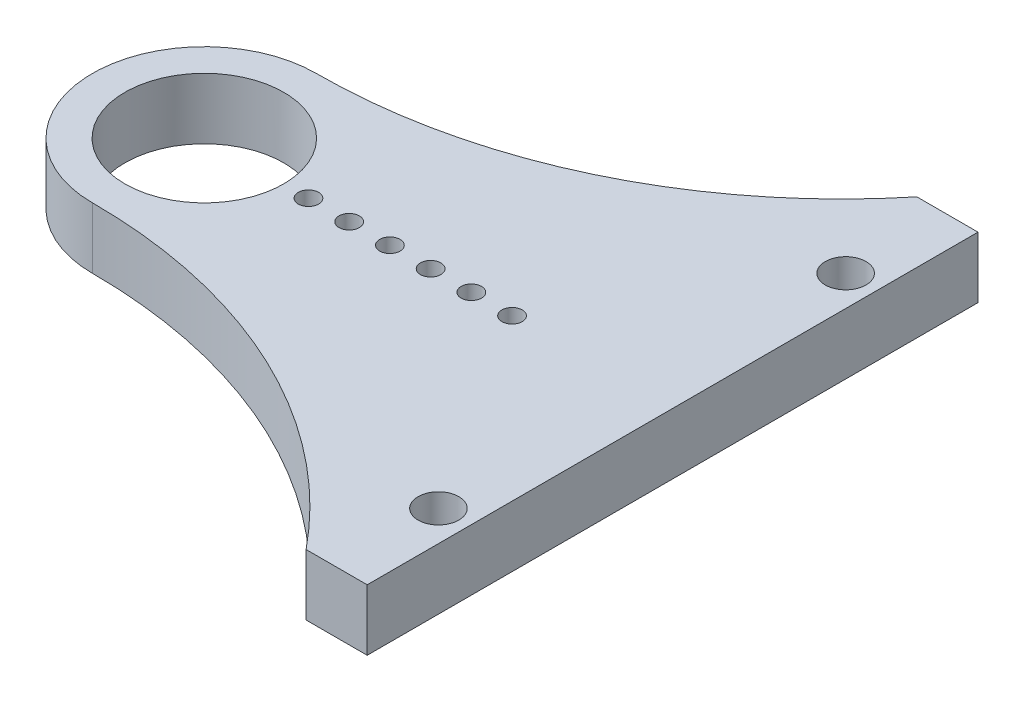
from build123d import *

# Parameters (mm, degrees)
SKETCH1_R           = 1
BOSS_EXTRUDE1_DEPTH = 3
SKETCH1_3_R         = 0.5
BOSS_EXTRUDE2_DEPTH = 1.5


with BuildPart() as part:
    # Sketch1 → Boss-Extrude1 (new body)
    with BuildSketch(Plane(origin=(0, 0, 0), x_dir=(1, 0, 0), z_dir=(0, 1, 0))):
        with BuildLine():
            ThreePointArc((-46.139075952, 38.780795182), (-35.068281039, 36.285100261), (-26.139075952, 29.280795182))
            Line((-26.139075952, 29.280795182), (-23.139075952, 29.280795182))
            Line((-23.139075952, 29.280795182), (-23.139075952, 59.280795182))
            Line((-23.139075952, 59.280795182), (-26.139075952, 59.280795182))
            ThreePointArc((-26.139075952, 59.280795182), (-35.068281039, 52.276490103), (-46.139075952, 49.780795182))
            ThreePointArc((-46.139075952, 49.780795182), (-51.639075952, 44.280795182), (-46.139075952, 38.780795182))
        make_face()
        with BuildLine():
            ThreePointArc((-43.42430156, 41.480795182), (-50.039075952, 44.280795182), (-43.42430156, 47.080795182))
            Line((-43.42430156, 47.080795182), (-31.023874876, 46.380795182))
            ThreePointArc((-31.023874876, 46.380795182), (-29.039075952, 44.280795182), (-31.023874876, 42.180795182))
            Line((-31.023874876, 42.180795182), (-43.42430156, 41.480795182))
        make_face(mode=Mode.SUBTRACT)
        with Locations((-24.639075952, 54.280795182)):
            Circle(SKETCH1_R, mode=Mode.SUBTRACT)
        with Locations((-24.639075952, 34.280795182)):
            Circle(SKETCH1_R, mode=Mode.SUBTRACT)
    extrude(amount=-BOSS_EXTRUDE1_DEPTH)

    # Sketch1<3> → Boss-Extrude2 (add)
    with BuildSketch(Plane(origin=(0, 0, 0), x_dir=(1, 0, 0), z_dir=(0, 1, 0))):
        with BuildLine():
            ThreePointArc((-43.42430156, 47.080795182), (-42.239075952, 44.280795182), (-43.42430156, 41.480795182))
            Line((-43.42430156, 41.480795182), (-31.023874876, 42.180795182))
            ThreePointArc((-31.023874876, 42.180795182), (-29.039075952, 44.280795182), (-31.023874876, 46.380795182))
            Line((-31.023874876, 46.380795182), (-43.42430156, 47.080795182))
        make_face()
        with Locations((-41.023874876, 44.280795182)):
            Circle(SKETCH1_3_R, mode=Mode.SUBTRACT)
        with Locations((-33.023874876, 44.280795182)):
            Circle(SKETCH1_3_R, mode=Mode.SUBTRACT)
        with Locations((-31.023874876, 44.280795182)):
            Circle(SKETCH1_3_R, mode=Mode.SUBTRACT)
        with Locations((-39.023874876, 44.280795182)):
            Circle(SKETCH1_3_R, mode=Mode.SUBTRACT)
        with Locations((-37.023874876, 44.280795182)):
            Circle(SKETCH1_3_R, mode=Mode.SUBTRACT)
        with Locations((-35.023874876, 44.280795182)):
            Circle(SKETCH1_3_R, mode=Mode.SUBTRACT)
    extrude(amount=-BOSS_EXTRUDE2_DEPTH)


solid = part.part
